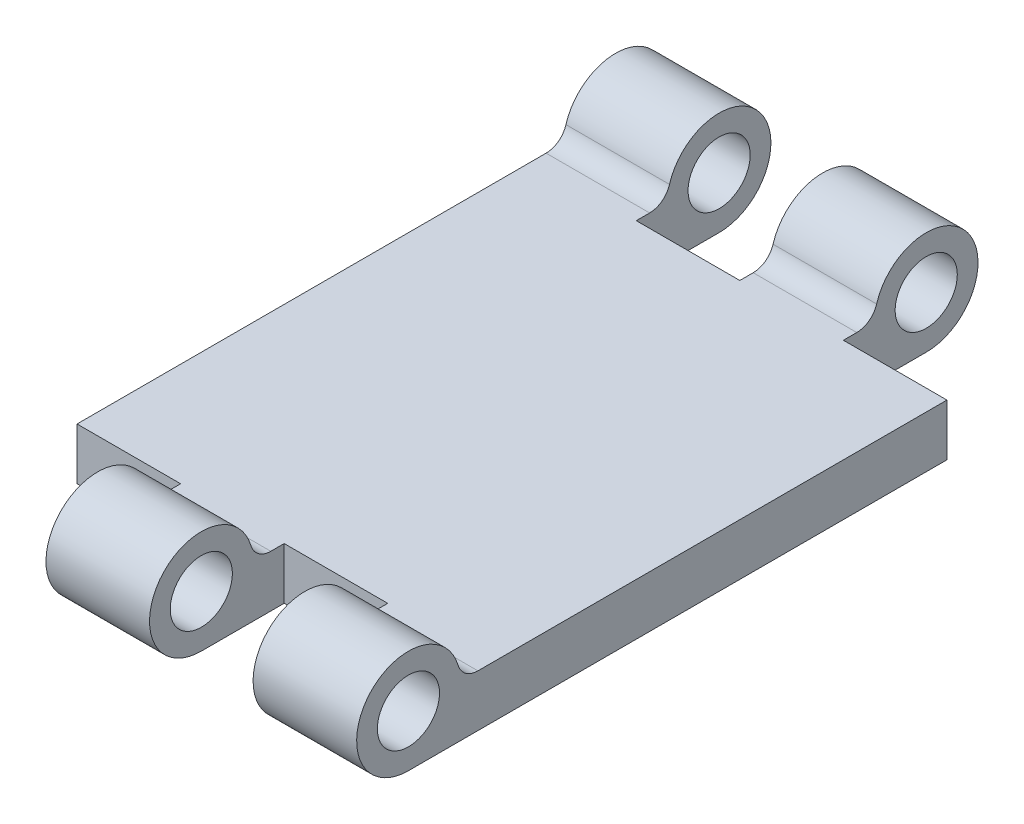
from build123d import *

# Parameters (mm, degrees)
BOSS_EXTRUDE1_DEPTH     = 500
BOSS_EXTRUDE2_START     = 250
SKETCH1_3_R             = 75
BOSS_EXTRUDE2_DEPTH     = 250
SKETCH1_4_R             = 75
BOSS_EXTRUDE3_DEPTH     = 250
BOSS_EXTRUDE4_START     = -250
SKETCH1_5_R             = 75
BOSS_EXTRUDE4_DEPTH     = 250
BOSS_EXTRUDE5_START     = 500
SKETCH1_6_R             = 75
BOSS_EXTRUDE5_DEPTH     = 250
CUT_EXTRUDE1_DEPTH      = 250
CUT_EXTRUDE1_DEPTH_BACK = 250
FILLET1_R               = 50


with BuildPart() as part:
    # Sketch1 → Boss-Extrude1 (new, symmetric)
    with BuildSketch(Plane(origin=(0, 0, 0), x_dir=(0, 0, -1), z_dir=(1, 0, 0))):
        with BuildLine():
            ThreePointArc((0, -125), (-88.388347648, -88.388347648), (-125, 0))
            Line((-125, 0), (-1375, 0))
            ThreePointArc((-1375, 0), (-1411.611652352, -88.388347648), (-1500, -125))
            Line((-1500, -125), (0, -125))
        make_face()
    extrude(amount=BOSS_EXTRUDE1_DEPTH, both=True)

    # Sketch1<3> → Boss-Extrude2 (add)
    with BuildSketch(Plane(origin=(0, 0, 0), x_dir=(0, 0, -1), z_dir=(1, 0, 0)).offset(BOSS_EXTRUDE2_START)):
        with BuildLine():
            ThreePointArc((125, 0), (0, 125), (-125, 0))
            ThreePointArc((-125, 0), (-88.388347648, -88.388347648), (0, -125))
            ThreePointArc((0, -125), (88.388347648, -88.388347648), (125, 0))
        make_face()
        Circle(SKETCH1_3_R, mode=Mode.SUBTRACT)
    extrude(amount=-BOSS_EXTRUDE2_DEPTH)

    # Sketch1<4> → Boss-Extrude3 (add)
    with BuildSketch(Plane(origin=(0, 0, 0), x_dir=(0, 0, -1), z_dir=(1, 0, 0))):
        with BuildLine():
            ThreePointArc((-1500, -125), (-1411.611652352, -88.388347648), (-1375, 0))
            ThreePointArc((-1375, 0), (-1588.388347648, 88.388347648), (-1500, -125))
        make_face()
        with Locations((-1500, 0)):
            Circle(SKETCH1_4_R, mode=Mode.SUBTRACT)
    extrude(amount=-BOSS_EXTRUDE3_DEPTH)

    # Sketch1<5> → Boss-Extrude4 (add)
    with BuildSketch(Plane(origin=(0, 0, 0), x_dir=(0, 0, -1), z_dir=(1, 0, 0)).offset(BOSS_EXTRUDE4_START)):
        with BuildLine():
            ThreePointArc((125, 0), (0, 125), (-125, 0))
            ThreePointArc((-125, 0), (-88.388347648, -88.388347648), (0, -125))
            ThreePointArc((0, -125), (88.388347648, -88.388347648), (125, 0))
        make_face()
        Circle(SKETCH1_5_R, mode=Mode.SUBTRACT)
    extrude(amount=-BOSS_EXTRUDE4_DEPTH)

    # Sketch1<6> → Boss-Extrude5 (add)
    with BuildSketch(Plane(origin=(0, 0, 0), x_dir=(0, 0, -1), z_dir=(1, 0, 0)).offset(BOSS_EXTRUDE5_START)):
        with BuildLine():
            ThreePointArc((-1500, -125), (-1411.611652352, -88.388347648), (-1375, 0))
            ThreePointArc((-1375, 0), (-1588.388347648, 88.388347648), (-1500, -125))
        make_face()
        with Locations((-1500, 0)):
            Circle(SKETCH1_6_R, mode=Mode.SUBTRACT)
    extrude(amount=-BOSS_EXTRUDE5_DEPTH)

    # Sketch2 → Cut-Extrude1 (cut, two sides: drawn at the far end of the back side and taken through both)
    with BuildSketch(Plane(origin=(0, 0, 0), x_dir=(1, 0, 0), z_dir=(0, 1, 0)).offset(-CUT_EXTRUDE1_DEPTH_BACK)):
        Polygon((-250, 550.682417094), (-250, -200), (0, -200), (0, 342.970708342), (250, 342.970708342), (250, -200), (760.214276003, -200), (760.214276003, 550.682417094), align=None)
        Polygon((250, -2214.630516483), (250, -1300), (0, -1300), (0, -1946.053133522), (-250, -1946.053133522), (-250, -1300), (-708.69599817, -1300), (-708.69599817, -2214.630516483), align=None)
    extrude(amount=CUT_EXTRUDE1_DEPTH + CUT_EXTRUDE1_DEPTH_BACK, mode=Mode.SUBTRACT)

    # Fillet1
    fillet1_edges = [part.edges().sort_by_distance(p)[0] for p in [
        (-125, 0, 1375),
        (375, 0, 1375),
        (125, 0, 125),
        (-375, 0, 125),
    ]]
    fillet(fillet1_edges, radius=FILLET1_R)


solid = part.part
